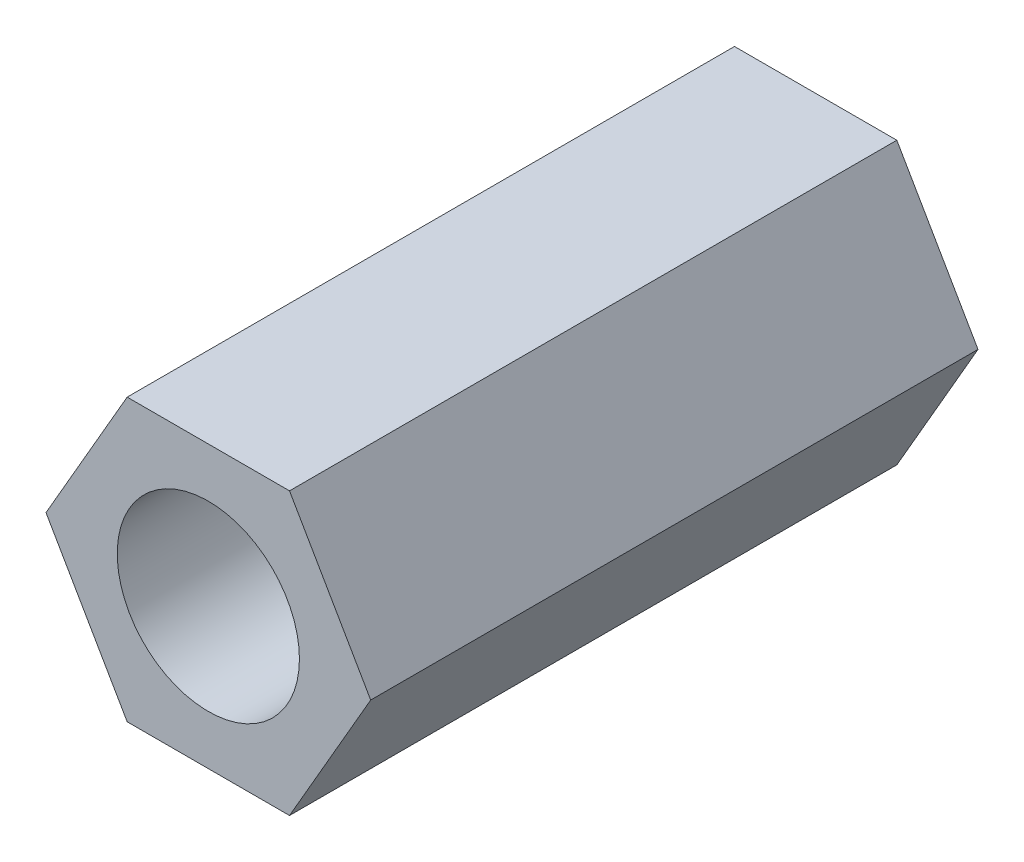
from build123d import *

# Parameters (mm, degrees)
SKETCH1_R           = 1.5
BOSS_EXTRUDE1_DEPTH = 10


with BuildPart() as part:
    # Sketch1 → Boss-Extrude1 (new body)
    with BuildSketch(Plane.XY):
        Polygon((2.673131746, 0), (1.336565873, 2.315), (-1.336565873, 2.315), (-2.673131746, 0), (-1.336565873, -2.315), (1.336565873, -2.315), align=None)
        Circle(SKETCH1_R, mode=Mode.SUBTRACT)
    extrude(amount=BOSS_EXTRUDE1_DEPTH)


solid = part.part
